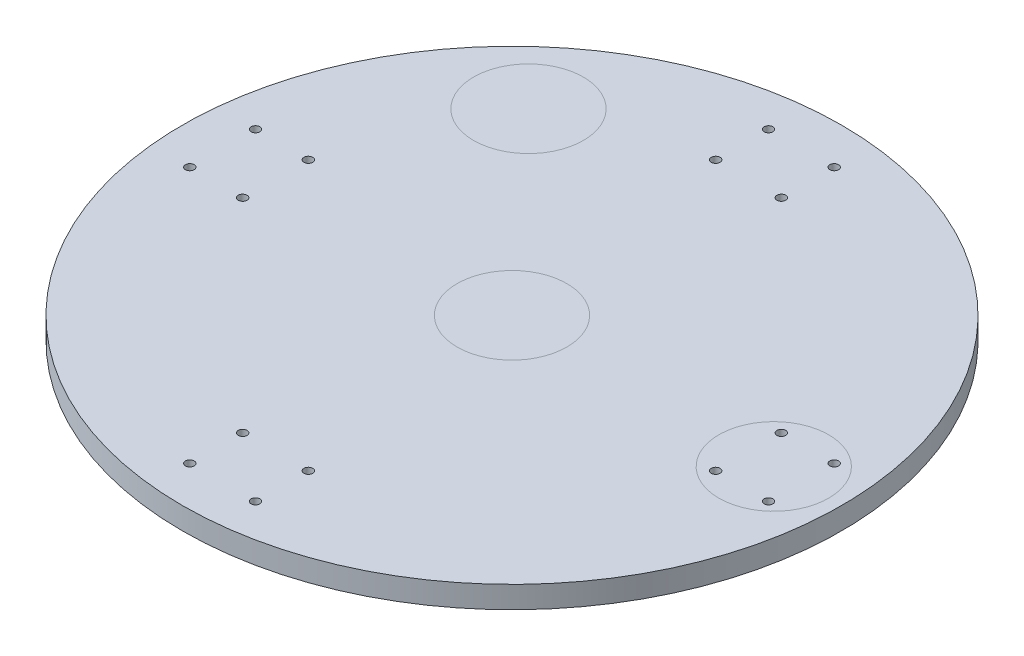
from build123d import *

# Parameters (mm, degrees)
SKETCH1_R           = 150
BOSS_EXTRUDE1_DEPTH = 10
SKETCH2_R           = 2
CUT_EXTRUDE1_DEPTH  = 10


with BuildPart() as part:
    # Sketch1 → Boss-Extrude1 (new body)
    with BuildSketch(Plane(origin=(0, 0, 0), x_dir=(1, 0, 0), z_dir=(0, 1, 0))):
        with Locations(Location((0, 0, 0), (0, 0, 270))):
            Circle(SKETCH1_R)
    extrude(amount=BOSS_EXTRUDE1_DEPTH)

    # Sketch2 → Cut-Extrude1 (cut)
    with BuildSketch(Plane(origin=(0, 10, 0), x_dir=(1, 0, 0), z_dir=(0, 1, 0))):
        with Locations(Location((-14.945, 131.706442493, 0), (0, 0, 270))):
            Circle(SKETCH2_R)
        with Locations(Location((-14.945, 107.646442493, 0), (0, 0, 270))):
            Circle(SKETCH2_R)
        with Locations(Location((14.945, 107.646442493, 0), (0, 0, 90))):
            Circle(SKETCH2_R)
        with Locations(Location((14.945, 131.706442493, 0), (0, 0, 90))):
            Circle(SKETCH2_R)
        with Locations(Location((131.706442493, 14.945, 0), (0, 0, 270))):
            Circle(SKETCH2_R)
        with Locations(Location((131.706442493, -14.945, 0), (0, 0, 90))):
            Circle(SKETCH2_R)
        with Locations(Location((107.646442493, -14.945, 0), (0, 0, 90))):
            Circle(SKETCH2_R)
        with Locations(Location((107.646442493, 14.945, 0), (0, 0, 270))):
            Circle(SKETCH2_R)
        with Locations(Location((14.945, -131.706442493, 0), (0, 0, 270))):
            Circle(SKETCH2_R)
        with Locations(Location((-14.945, -131.706442493, 0), (0, 0, 90))):
            Circle(SKETCH2_R)
        with Locations(Location((-14.945, -107.646442493, 0), (0, 0, 90))):
            Circle(SKETCH2_R)
        with Locations(Location((14.945, -107.646442493, 0), (0, 0, 270))):
            Circle(SKETCH2_R)
        with Locations(Location((-131.706442493, -14.945, 0), (0, 0, 270))):
            Circle(SKETCH2_R)
        with Locations(Location((-131.706442493, 14.945, 0), (0, 0, 90))):
            Circle(SKETCH2_R)
        with Locations(Location((-107.646442493, 14.945, 0), (0, 0, 90))):
            Circle(SKETCH2_R)
        with Locations(Location((-107.646442493, -14.945, 0), (0, 0, 270))):
            Circle(SKETCH2_R)
    extrude(amount=-CUT_EXTRUDE1_DEPTH, mode=Mode.SUBTRACT)


solid = part.part
